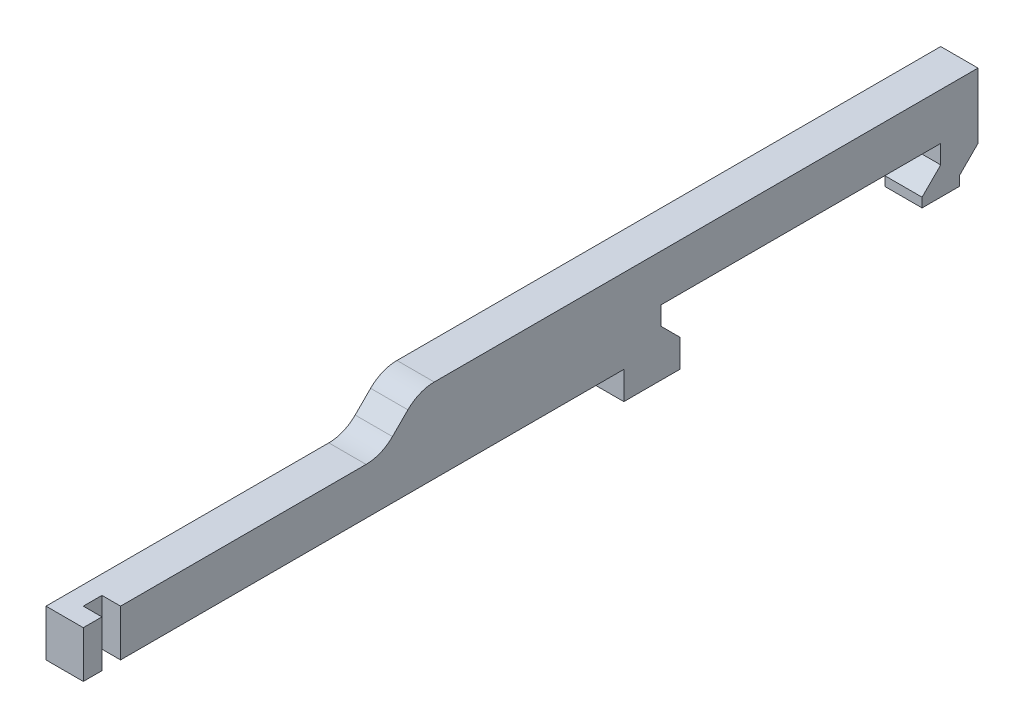
from build123d import *

# Parameters (mm, degrees)
SKETCH_1_W          = 16
SKETCH_1_H          = 2.5
EXTRUDE_1_DEPTH     = 2
FILLET_1_R          = 2
SKETCH_2_W          = 1
SKETCH_2_H          = 1
CUT_EXTRUDE_1_DEPTH = 49.207883173


with BuildPart() as part:
    # Эскиз1 → Бобышка-Вытянуть1 (new body)
    with BuildSketch(Plane(origin=(0, 0, 0), x_dir=(0, 0, -1), z_dir=(1, 0, 0))):
        Polygon((48, 1), (48, 4.5), (29, 4.5), (18, 4.5), (16, 2.5), (16, 0), (29, 0), (29, -1.5), (32, -1.5), (32, 0), (31, 1), (31, 2), (46, 2), (46, 1), (45, 0), (45, -0.5), (47, -0.5), (47, 0), align=None)
        with Locations((8, 1.25)):
            Rectangle(SKETCH_1_W, SKETCH_1_H)
    extrude(amount=EXTRUDE_1_DEPTH)

    # Скругление1
    fillet_1_edges = [part.edges().sort_by_distance(p)[0] for p in [
        (1, 2.5, -16),
        (1, 4.5, -18),
    ]]
    fillet(fillet_1_edges, radius=FILLET_1_R)

    # Эскиз2 → Вырез-Вытянуть1 (cut, through all)
    with BuildSketch(Plane(origin=(0, 2.5, 0), x_dir=(1, 0, 0), z_dir=(0, 1, 0))):
        with Locations((1.5, 1.5)):
            Rectangle(SKETCH_2_W, SKETCH_2_H)
    extrude(amount=-CUT_EXTRUDE_1_DEPTH, mode=Mode.SUBTRACT)


solid = part.part
